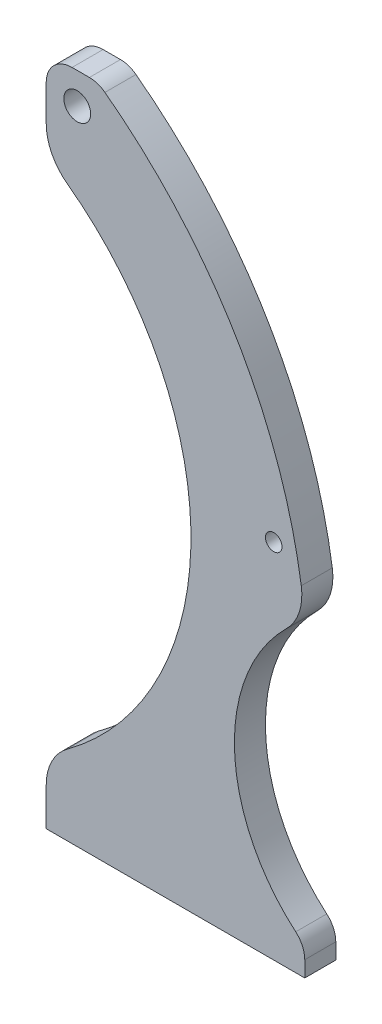
from build123d import *

# Parameters (mm, degrees)
ESQUISSE1_W             = 50
ESQUISSE1_H             = 130
EXTRUSION1_DEPTH        = 6
ESQUISSE3_R             = 2.6
ESQUISSE3_R_2           = 1.6
ENL_V_MAT_EXTRU_1_DEPTH = 6
ENL_V_MAT_EXTRU_2_DEPTH = 20
CONG_1_R                = 10
CONG_2_R                = 5


with BuildPart() as part:
    # Esquisse1 → Extrusion1 (new body)
    with BuildSketch(Plane.XY):
        with Locations((-2.937764085, -11.025)):
            Rectangle(ESQUISSE1_W, ESQUISSE1_H)
    extrude(amount=EXTRUSION1_DEPTH)

    # Esquisse3 → Enlèv. mat.-Extru.1 (cut)
    with BuildSketch(Plane.XY.offset(6)):
        with Locations((-21.937764085, 47.975)):
            Circle(ESQUISSE3_R)
        with Locations((16.062235915, -6.025)):
            Circle(ESQUISSE3_R_2)
        Polygon((-7.937764085, 53.975), (22.062235915, 3.975), (22.062235915, 53.975), align=None)
    extrude(amount=-ENL_V_MAT_EXTRU_1_DEPTH, mode=Mode.SUBTRACT)

    # Esquisse4 → Enlèv. mat.-Extru.2 (cut)
    with BuildSketch(Plane.XY.offset(6)):
        with BuildLine():
            Line((-27.937764085, 36.785641628), (-27.937764085, -63.408020344))
            ThreePointArc((-27.937764085, -63.408020344), (0.051382603, -13.311189358), (-27.937764085, 36.785641628))
        make_face()
        with BuildLine():
            Line((-17.937764085, 53.975), (9.122584116, 53.975))
            Line((9.122584116, 53.975), (35.098718701, 7.628755869))
            Line((35.098718701, 7.628755869), (22.062235915, -70.564710485))
            ThreePointArc((22.062235915, -70.564710485), (8.455247334, -43.39579421), (22.062235915, -16.226877934))
            ThreePointArc((22.062235915, -16.226877934), (9.650339, 23.197650833), (-17.937764085, 53.975))
        make_face()
    extrude(amount=-ENL_V_MAT_EXTRU_2_DEPTH, mode=Mode.SUBTRACT)

    # Congé1
    cong_1_edges = [part.edges().sort_by_distance(p)[0] for p in [
        (-27.937764085, 36.785641628, 3),
        (-27.937764085, -63.408020344, 3),
        (22.062235915, -16.226877934, 3),
    ]]
    fillet(cong_1_edges, radius=CONG_1_R)

    # Congé2
    cong_2_edges = [part.edges().sort_by_distance(p)[0] for p in [
        (22.062235915, -70.564710485, 3),
        (-17.937764085, 53.975, 3),
        (-27.937764085, 53.975, 3),
    ]]
    fillet(cong_2_edges, radius=CONG_2_R)


solid = part.part
